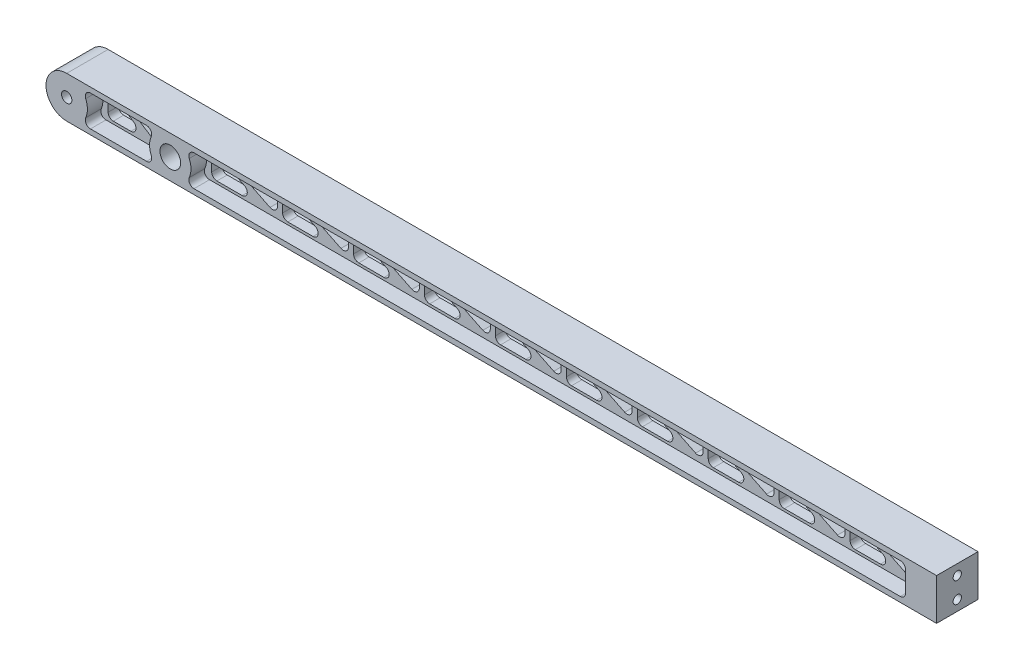
from build123d import *

# Parameters (mm, degrees)
BOSS_EXTRUDE1_DEPTH         = 12.7
SKETCH1_10_R                = 3.175
SKETCH1_10_R_2              = 6.35
CUT_EXTRUDE3_DEPTH          = 12.7
CUT_EXTRUDE5_DEPTH          = 611.657416233
CUT_EXTRUDE7_DEPTH          = 9.525
FILLET1_R                   = 3.175
F_1_4_20_TAPPED_HOLE1_D     = 5.1054
F_1_4_20_TAPPED_HOLE1_DEPTH = 12.7
F_1_4_20_TAPPED_HOLE1_TIP   = 1.533816902


with BuildPart() as part:
    # Sketch1 → Boss-Extrude1 (new, symmetric)
    with BuildSketch(Plane.XY):
        with BuildLine():
            Line((609.6, 0), (609.6, 25.4))
            Line((609.6, 25.4), (76.2, 25.4))
            ThreePointArc((76.2, 25.4), (63.5, 12.7), (76.2, 0))
            Line((76.2, 0), (609.6, 0))
        make_face()
    extrude(amount=BOSS_EXTRUDE1_DEPTH, both=True)

    # Sketch1<10> → Cut-Extrude3 (cut, symmetric)
    with BuildSketch(Plane.XY):
        with Locations((76.2, 12.7)):
            Circle(SKETCH1_10_R)
        with Locations((139.699994312, 12.7)):
            Circle(SKETCH1_10_R_2)
    extrude(amount=CUT_EXTRUDE3_DEPTH, both=True, mode=Mode.SUBTRACT)

    # Sketch3 → Cut-Extrude5 (cut, through all)
    with BuildSketch(Plane.XY.offset(12.7)):
        Polygon((92.075, 4.7625), (116.837081699, 4.7625), (92.075, 20.6375), align=None)
        Polygon((123.824994312, 4.7625), (123.824994312, 20.6375), (99.062912613, 20.6375), align=None)
        Polygon((155.574994312, 4.7625), (187.876758937, 4.7625), (155.574994312, 20.6375), align=None)
        Polygon((195.897494881, 4.7625), (195.897494881, 20.6375), (163.595730256, 20.6375), align=None)
        Polygon((199.072494881, 4.7625), (231.374259505, 4.7625), (199.072494881, 20.6375), align=None)
        Polygon((239.394995449, 4.7625), (239.394995449, 20.6375), (207.093230824, 20.6375), align=None)
        Polygon((286.067496018, 4.7625), (318.369260643, 4.7625), (286.067496018, 20.6375), align=None)
        Polygon((329.564996587, 4.7625), (361.866761212, 4.7625), (329.564996587, 20.6375), align=None)
        Polygon((369.887497156, 4.7625), (369.887497156, 20.6375), (337.585732531, 20.6375), align=None)
        Polygon((373.062497156, 4.7625), (405.364261781, 4.7625), (373.062497156, 20.6375), align=None)
        Polygon((413.384997725, 4.7625), (413.384997725, 20.6375), (381.0832331, 20.6375), align=None)
        Polygon((416.559997725, 4.7625), (448.86176235, 4.7625), (416.559997725, 20.6375), align=None)
        Polygon((456.882498294, 4.7625), (456.882498294, 20.6375), (424.580733669, 20.6375), align=None)
        Polygon((460.057498294, 4.7625), (492.359262919, 4.7625), (460.057498294, 20.6375), align=None)
        Polygon((500.379998862, 4.7625), (500.379998862, 20.6375), (468.078234237, 20.6375), align=None)
        Polygon((503.554998862, 4.7625), (535.856763487, 4.7625), (503.554998862, 20.6375), align=None)
        Polygon((543.877499431, 4.7625), (543.877499431, 20.6375), (511.575734806, 20.6375), align=None)
        Polygon((547.052499431, 4.7625), (579.354264056, 4.7625), (547.052499431, 20.6375), align=None)
        Polygon((587.375, 4.7625), (587.375, 20.6375), (555.073235375, 20.6375), align=None)
        Polygon((274.871760074, 4.7625), (242.569995449, 20.6375), (242.569995449, 4.7625), align=None)
        Polygon((282.892496018, 20.6375), (250.590731393, 20.6375), (282.892496018, 4.7625), align=None)
        Polygon((326.389996587, 20.6375), (294.088231962, 20.6375), (326.389996587, 4.7625), align=None)
    extrude(amount=-CUT_EXTRUDE5_DEPTH, mode=Mode.SUBTRACT)

    # Sketch3<5> → Cut-Extrude7 (cut)
    # profile 1 of 2: a face of its own
    with BuildSketch(Plane.XY.offset(12.7)):
        with BuildLine():
            Line((84.600260413, 3.175), (131.299733899, 3.175))
            ThreePointArc((131.299733899, 3.175), (126.999994312, 12.7), (131.299733899, 22.225))
            Line((131.299733899, 22.225), (84.600260413, 22.225))
            ThreePointArc((84.600260413, 22.225), (88.9, 12.7), (84.600260413, 3.175))
        make_face()
        Polygon((92.075, 4.7625), (92.075, 20.6375), (104.45604085, 12.7), (116.837081699, 4.7625), align=None, mode=Mode.SUBTRACT)
        Polygon((123.824994312, 4.7625), (106.491537122, 15.875), (99.062912613, 20.6375), (123.824994312, 20.6375), align=None, mode=Mode.SUBTRACT)
    # profile 2 of 2: a face of its own
    with BuildSketch(Plane.XY.offset(12.7)):
        with BuildLine():
            Line((148.100254724, 3.175), (590.55, 3.175))
            Line((590.55, 3.175), (590.55, 22.225))
            Line((590.55, 22.225), (148.100254724, 22.225))
            ThreePointArc((148.100254724, 22.225), (152.399994312, 12.7), (148.100254724, 3.175))
        make_face()
        Polygon((155.574994312, 4.7625), (155.574994312, 20.6375), (171.725876624, 12.7), (187.876758937, 4.7625), align=None, mode=Mode.SUBTRACT)
        Polygon((199.072494881, 4.7625), (199.072494881, 20.6375), (215.223377193, 12.7), (231.374259505, 4.7625), align=None, mode=Mode.SUBTRACT)
        Polygon((239.394995449, 4.7625), (216.783760212, 15.875), (207.093230824, 20.6375), (239.394995449, 20.6375), align=None, mode=Mode.SUBTRACT)
        Polygon((242.569995449, 4.7625), (242.569995449, 20.6375), (258.720877762, 12.7), (274.871760074, 4.7625), align=None, mode=Mode.SUBTRACT)
        Polygon((282.892496018, 4.7625), (260.281260781, 15.875), (250.590731393, 20.6375), (282.892496018, 20.6375), align=None, mode=Mode.SUBTRACT)
        Polygon((286.067496018, 4.7625), (286.067496018, 20.6375), (302.218378331, 12.7), (318.369260643, 4.7625), align=None, mode=Mode.SUBTRACT)
        Polygon((326.389996587, 4.7625), (303.77876135, 15.875), (294.088231962, 20.6375), (326.389996587, 20.6375), align=None, mode=Mode.SUBTRACT)
        Polygon((329.564996587, 4.7625), (329.564996587, 20.6375), (345.7158789, 12.7), (361.866761212, 4.7625), align=None, mode=Mode.SUBTRACT)
        Polygon((369.887497156, 4.7625), (347.276261918, 15.875), (337.585732531, 20.6375), (369.887497156, 20.6375), align=None, mode=Mode.SUBTRACT)
        Polygon((373.062497156, 4.7625), (373.062497156, 20.6375), (389.213379468, 12.7), (405.364261781, 4.7625), align=None, mode=Mode.SUBTRACT)
        Polygon((413.384997725, 4.7625), (390.773762487, 15.875), (381.0832331, 20.6375), (413.384997725, 20.6375), align=None, mode=Mode.SUBTRACT)
        Polygon((416.559997725, 4.7625), (416.559997725, 20.6375), (432.710880037, 12.7), (448.86176235, 4.7625), align=None, mode=Mode.SUBTRACT)
        Polygon((456.882498294, 4.7625), (434.271263056, 15.875), (424.580733669, 20.6375), (456.882498294, 20.6375), align=None, mode=Mode.SUBTRACT)
        Polygon((460.057498294, 4.7625), (460.057498294, 20.6375), (476.208380606, 12.7), (492.359262919, 4.7625), align=None, mode=Mode.SUBTRACT)
        Polygon((500.379998862, 4.7625), (477.768763625, 15.875), (468.078234237, 20.6375), (500.379998862, 20.6375), align=None, mode=Mode.SUBTRACT)
        Polygon((503.554998862, 4.7625), (503.554998862, 20.6375), (519.705881175, 12.7), (535.856763487, 4.7625), align=None, mode=Mode.SUBTRACT)
        Polygon((543.877499431, 4.7625), (521.266264194, 15.875), (511.575734806, 20.6375), (543.877499431, 20.6375), align=None, mode=Mode.SUBTRACT)
        Polygon((547.052499431, 4.7625), (547.052499431, 20.6375), (563.203381744, 12.7), (579.354264056, 4.7625), align=None, mode=Mode.SUBTRACT)
        Polygon((587.375, 4.7625), (564.763764763, 15.875), (555.073235375, 20.6375), (587.375, 20.6375), align=None, mode=Mode.SUBTRACT)
        Polygon((195.897494881, 4.7625), (173.286259643, 15.875), (163.595730256, 20.6375), (195.897494881, 20.6375), align=None, mode=Mode.SUBTRACT)
    cut_extrude7 = extrude(amount=-CUT_EXTRUDE7_DEPTH, mode=Mode.SUBTRACT)

    # Mirror1: Cut-Extrude7 across plane
    add(cut_extrude7.mirror(Plane.XY), mode=Mode.SUBTRACT)

    # Fillet1
    fillet1_edges = [part.edges().sort_by_distance(p)[0] for p in [
        (148.100254724, 3.175, 7.9375),
        (148.100254724, 22.225, 7.9375),
        (590.55, 22.225, 7.9375),
        (590.55, 3.175, 7.9375),
        (131.299733899, 3.175, 7.9375),
        (84.600260413, 3.175, 7.9375),
        (84.600260413, 22.225, 7.9375),
        (131.299733899, 22.225, 7.9375),
        (294.088231962, 20.6375, 0),
        (326.389996587, 20.6375, 0),
        (326.389996587, 4.7625, 0),
        (250.590731393, 20.6375, 0),
        (282.892496018, 20.6375, 0),
        (282.892496018, 4.7625, 0),
        (242.569995449, 20.6375, 0),
        (274.871760074, 4.7625, 0),
        (242.569995449, 4.7625, 0),
        (555.073235375, 20.6375, 0),
        (587.375, 20.6375, 0),
        (587.375, 4.7625, 0),
        (547.052499431, 20.6375, 0),
        (579.354264056, 4.7625, 0),
        (547.052499431, 4.7625, 0),
        (511.575734806, 20.6375, 0),
        (543.877499431, 20.6375, 0),
        (543.877499431, 4.7625, 0),
        (503.554998862, 20.6375, 0),
        (535.856763487, 4.7625, 0),
        (503.554998862, 4.7625, 0),
        (468.078234237, 20.6375, 0),
        (500.379998862, 20.6375, 0),
        (500.379998862, 4.7625, 0),
        (460.057498294, 20.6375, 0),
        (492.359262919, 4.7625, 0),
        (460.057498294, 4.7625, 0),
        (424.580733669, 20.6375, 0),
        (456.882498294, 20.6375, 0),
        (456.882498294, 4.7625, 0),
        (416.559997725, 20.6375, 0),
        (448.86176235, 4.7625, 0),
        (416.559997725, 4.7625, 0),
        (381.0832331, 20.6375, 0),
        (413.384997725, 20.6375, 0),
        (413.384997725, 4.7625, 0),
        (373.062497156, 20.6375, 0),
        (405.364261781, 4.7625, 0),
        (373.062497156, 4.7625, 0),
        (337.585732531, 20.6375, 0),
        (369.887497156, 20.6375, 0),
        (369.887497156, 4.7625, 0),
        (329.564996587, 20.6375, 0),
        (361.866761212, 4.7625, 0),
        (329.564996587, 4.7625, 0),
        (286.067496018, 20.6375, 0),
        (318.369260643, 4.7625, 0),
        (286.067496018, 4.7625, 0),
        (207.093230824, 20.6375, 0),
        (239.394995449, 20.6375, 0),
        (239.394995449, 4.7625, 0),
        (199.072494881, 20.6375, 0),
        (231.374259505, 4.7625, 0),
        (199.072494881, 4.7625, 0),
        (163.595730256, 20.6375, 0),
        (195.897494881, 20.6375, 0),
        (195.897494881, 4.7625, 0),
        (155.574994312, 20.6375, 0),
        (187.876758937, 4.7625, 0),
        (155.574994312, 4.7625, 0),
        (148.100254724, 22.225, -7.9375),
        (148.100254724, 3.175, -7.9375),
        (590.55, 3.175, -7.9375),
        (590.55, 22.225, -7.9375),
        (99.062912613, 20.6375, 0),
        (123.824994312, 20.6375, 0),
        (123.824994312, 4.7625, 0),
        (92.075, 20.6375, 0),
        (116.837081699, 4.7625, 0),
        (92.075, 4.7625, 0),
        (84.600260413, 3.175, -7.9375),
        (131.299733899, 3.175, -7.9375),
        (131.299733899, 22.225, -7.9375),
        (84.600260413, 22.225, -7.9375),
    ]]
    fillet(fillet1_edges, radius=FILLET1_R)

    # 1/4-20 Tapped Hole1
    with Locations(Plane(origin=(609.6, 19.05, 0), x_dir=(0, 0, 1), z_dir=(1, 0, 0))):
        with Locations((0, 0), (0, 12.7)):
            Hole(F_1_4_20_TAPPED_HOLE1_D / 2, depth=F_1_4_20_TAPPED_HOLE1_DEPTH)
            with Locations((0, 0, -(F_1_4_20_TAPPED_HOLE1_DEPTH + F_1_4_20_TAPPED_HOLE1_TIP / 2))):  # 118° drill point
                Cone(0, F_1_4_20_TAPPED_HOLE1_D / 2, F_1_4_20_TAPPED_HOLE1_TIP, mode=Mode.SUBTRACT)


solid = part.part
